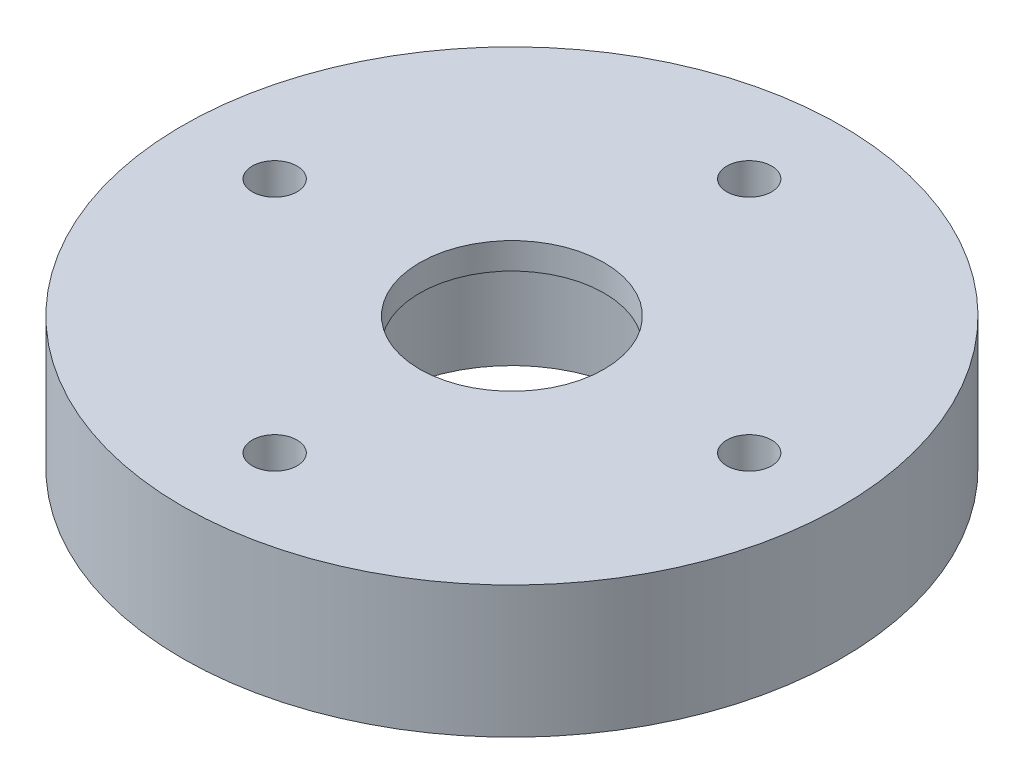
from build123d import *

# Parameters (mm, degrees)
SKETCH1_R           = 25
SKETCH1_R_2         = 7
SKETCH1_R_3         = 1.7
BOSS_EXTRUDE1_DEPTH = 10
SKETCH2_R           = 9.53
CUT_EXTRUDE1_DEPTH  = 8
SKETCH4_R           = 3
CUT_EXTRUDE2_DEPTH  = 7


with BuildPart() as part:
    # Sketch1 → Boss-Extrude1 (new body)
    with BuildSketch(Plane(origin=(0, 0, 0), x_dir=(1, 0, 0), z_dir=(0, 1, 0))):
        with Locations(Location((0, 0, 0), (0, 0, 270))):
            Circle(SKETCH1_R)
        with Locations(Location((0, 0, 0), (0, 0, 270))):
            Circle(SKETCH1_R_2, mode=Mode.SUBTRACT)
        with Locations(Location((0, 18, 0), (0, 0, 270))):
            Circle(SKETCH1_R_3, mode=Mode.SUBTRACT)
        with Locations(Location((18, 0, 0), (0, 0, 270))):
            Circle(SKETCH1_R_3, mode=Mode.SUBTRACT)
        with Locations(Location((0, -18, 0), (0, 0, 270))):
            Circle(SKETCH1_R_3, mode=Mode.SUBTRACT)
        with Locations(Location((-18, 0, 0), (0, 0, 270))):
            Circle(SKETCH1_R_3, mode=Mode.SUBTRACT)
    extrude(amount=BOSS_EXTRUDE1_DEPTH)

    # Sketch2 → Cut-Extrude1 (cut)
    with BuildSketch(Plane.XZ):
        with Locations(Location((0, 0, 0), (0, 0, 270))):
            Circle(SKETCH2_R)
    extrude(amount=-CUT_EXTRUDE1_DEPTH, mode=Mode.SUBTRACT)

    # Sketch4 → Cut-Extrude2 (cut)
    with BuildSketch(Plane.XZ):
        with Locations(Location((0, 18, 0), (0, 0, 270))):
            Circle(SKETCH4_R)
        with Locations(Location((-18, 0, 0), (0, 0, 270))):
            Circle(SKETCH4_R)
        with Locations(Location((0, -18, 0), (0, 0, 270))):
            Circle(SKETCH4_R)
        with Locations(Location((18, 0, 0), (0, 0, 270))):
            Circle(SKETCH4_R)
    extrude(amount=-CUT_EXTRUDE2_DEPTH, mode=Mode.SUBTRACT)


solid = part.part
